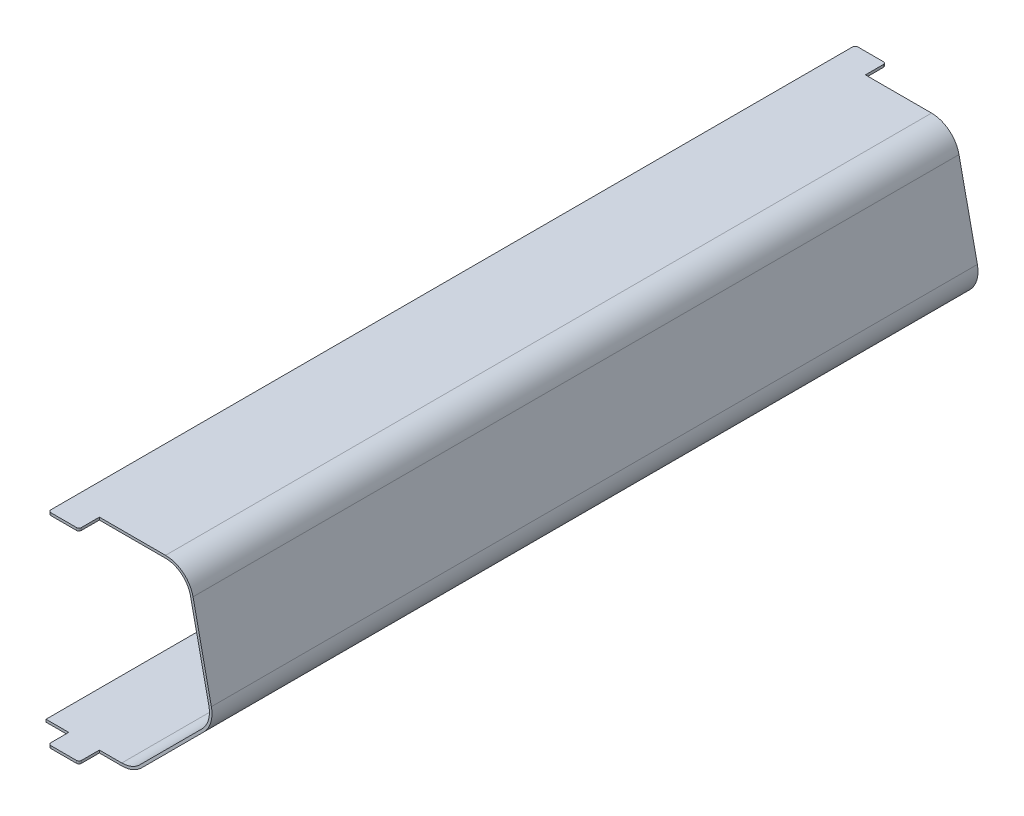
from build123d import *

# Parameters (mm, degrees)
BOSS_EXTRUDE1_DEPTH = 150
BOSS_EXTRUDE2_DEPTH = 0.5
BOSS_EXTRUDE3_START = -0.5
BOSS_EXTRUDE3_DEPTH = 0.5


with BuildPart() as part:
    # Sketch1 → Boss-Extrude1 (new body)
    with BuildSketch(Plane.XY):
        with BuildLine():
            Line((0, 0), (14.838134608, 0))
            ThreePointArc((14.838134608, 0), (16.75155177, 0.380602337), (18.373668514, 1.464466094))
            Line((18.373668514, 1.464466094), (30.543324162, 13.634121742))
            ThreePointArc((30.543324162, 13.634121742), (31.802691096, 15.752289806), (31.897349569, 18.214744029))
            Line((31.897349569, 18.214744029), (28.300052509, 35.045088382))
            ThreePointArc((28.300052509, 35.045088382), (26.554897598, 37.887508322), (23.410493196, 39))
            Line((23.410493196, 39), (4.454734574, 39))
            Line((4.454734574, 39), (4.454734574, 39.5))
            Line((4.454734574, 39.5), (23.410493196, 39.5))
            ThreePointArc((23.410493196, 39.5), (26.869338039, 38.276259154), (28.78900844, 35.14959722))
            Line((28.78900844, 35.14959722), (32.3863055, 18.319252867))
            ThreePointArc((32.3863055, 18.319252867), (32.282181181, 15.610553222), (30.896877552, 13.280568351))
            Line((30.896877552, 13.280568351), (18.727221905, 1.110912703))
            ThreePointArc((18.727221905, 1.110912703), (16.942893486, -0.081337429), (14.838134608, -0.5))
            Line((14.838134608, -0.5), (0, -0.5))
            Line((0, -0.5), (0, 0))
        make_face()
    extrude(amount=-BOSS_EXTRUDE1_DEPTH)

    # Sketch2 → Boss-Extrude2 (add)
    with BuildSketch(Plane(origin=(0, 39.5, 0), x_dir=(1, 0, 0), z_dir=(0, 1, 0))):
        with BuildLine():
            Line((4.454734574, 150), (4.454734574, 153.5))
            ThreePointArc((4.454734574, 153.5), (4.601181183, 153.853553391), (4.954734574, 154))
            Line((4.954734574, 154), (9.954734574, 154))
            ThreePointArc((9.954734574, 154), (10.308287964, 153.853553391), (10.454734574, 153.5))
            Line((10.454734574, 153.5), (10.454734574, 150))
            Line((10.454734574, 150), (4.454734574, 150))
        make_face()
        with BuildLine():
            Line((4.454734574, 0), (10.454734574, 0))
            Line((10.454734574, 0), (10.454734574, -3.5))
            ThreePointArc((10.454734574, -3.5), (10.308287964, -3.853553391), (9.954734574, -4))
            Line((9.954734574, -4), (4.954734574, -4))
            ThreePointArc((4.954734574, -4), (4.601181183, -3.853553391), (4.454734574, -3.5))
            Line((4.454734574, -3.5), (4.454734574, 0))
        make_face()
    extrude(amount=-BOSS_EXTRUDE2_DEPTH)

    # Sketch3 → Boss-Extrude3 (add)
    with BuildSketch(Plane.XZ.offset(0.5).offset(BOSS_EXTRUDE3_START)):
        with BuildLine():
            Line((10.454734574, -150), (4.454734574, -150))
            Line((4.454734574, -150), (4.454734574, -153.5))
            ThreePointArc((4.454734574, -153.5), (4.601181183, -153.853553391), (4.954734574, -154))
            Line((4.954734574, -154), (9.954734574, -154))
            ThreePointArc((9.954734574, -154), (10.308287964, -153.853553391), (10.454734574, -153.5))
            Line((10.454734574, -153.5), (10.454734574, -150))
        make_face()
        with BuildLine():
            Line((10.454734574, 0), (10.454734574, 3.5))
            ThreePointArc((10.454734574, 3.5), (10.308287964, 3.853553391), (9.954734574, 4))
            Line((9.954734574, 4), (4.954734574, 4))
            ThreePointArc((4.954734574, 4), (4.601181183, 3.853553391), (4.454734574, 3.5))
            Line((4.454734574, 3.5), (4.454734574, 0))
            Line((4.454734574, 0), (10.454734574, 0))
        make_face()
    extrude(amount=BOSS_EXTRUDE3_DEPTH)


solid = part.part
